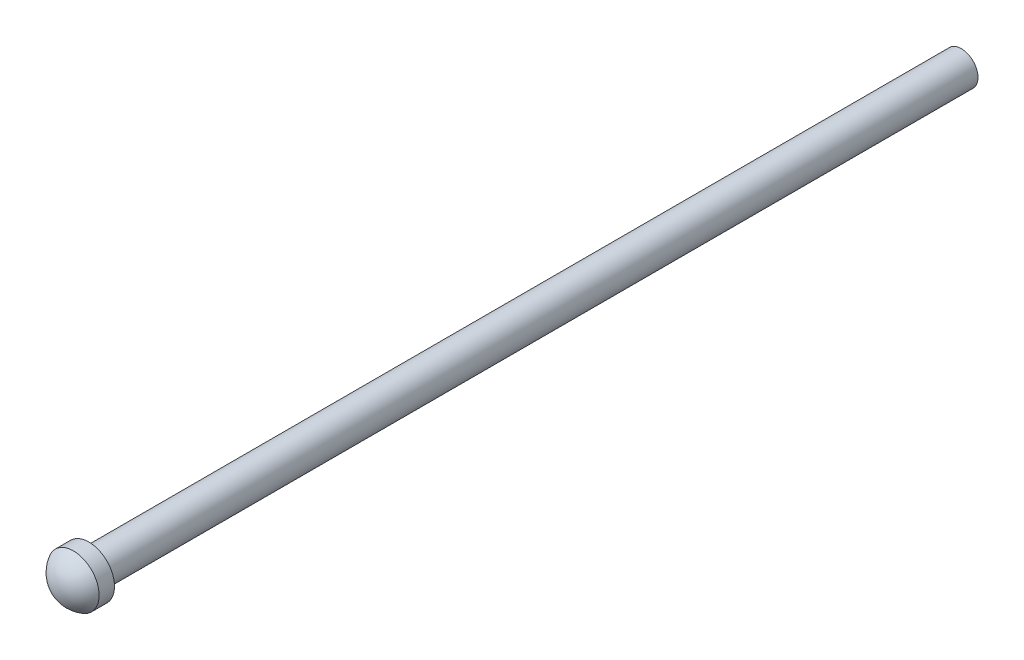
from build123d import *

# Parameters (mm, degrees)
SKETCH1_R           = 3.25
SKETCH4_R           = 5
BOSS_EXTRUDE1_DEPTH = 3
DOME1_FACE_RADIUS   = 5
DOME1_HEIGHT        = 3


with BuildPart() as part:
    # Sweep1: sweep along a path in Sketch2
    with BuildLine(Plane(origin=(0, 0, 0), x_dir=(0, 0, -1), z_dir=(1, 0, 0))) as sweep1_path:
        Line((0, 0), (170, 0))
    # Sketch1 → Sweep1 (sweep)
    with BuildSketch(Plane.XY):
        with Locations((5, 60)):
            Circle(SKETCH1_R)
    sweep(path=sweep1_path.line)

    # Sketch4 → Boss-Extrude1 (add)
    with BuildSketch(Plane.XY):
        with Locations((5, 60)):
            Circle(SKETCH4_R)
    extrude(amount=BOSS_EXTRUDE1_DEPTH)

    # Dome1: a dome of height H over a round flat face of radius A is a cap of a sphere of radius (A * A + H * H) / (2 * H)
    dome1_r = (DOME1_FACE_RADIUS * DOME1_FACE_RADIUS + DOME1_HEIGHT * DOME1_HEIGHT) / (2 * DOME1_HEIGHT)
    dome1_base = Plane((5, 60, 3), z_dir=(0, 0, 1))
    with Locations(dome1_base.offset(DOME1_HEIGHT - dome1_r)):
        dome1_ball = Sphere(dome1_r, mode=Mode.PRIVATE)
    add(split(dome1_ball, bisect_by=dome1_base, keep=Keep.TOP, mode=Mode.PRIVATE))


solid = part.part
